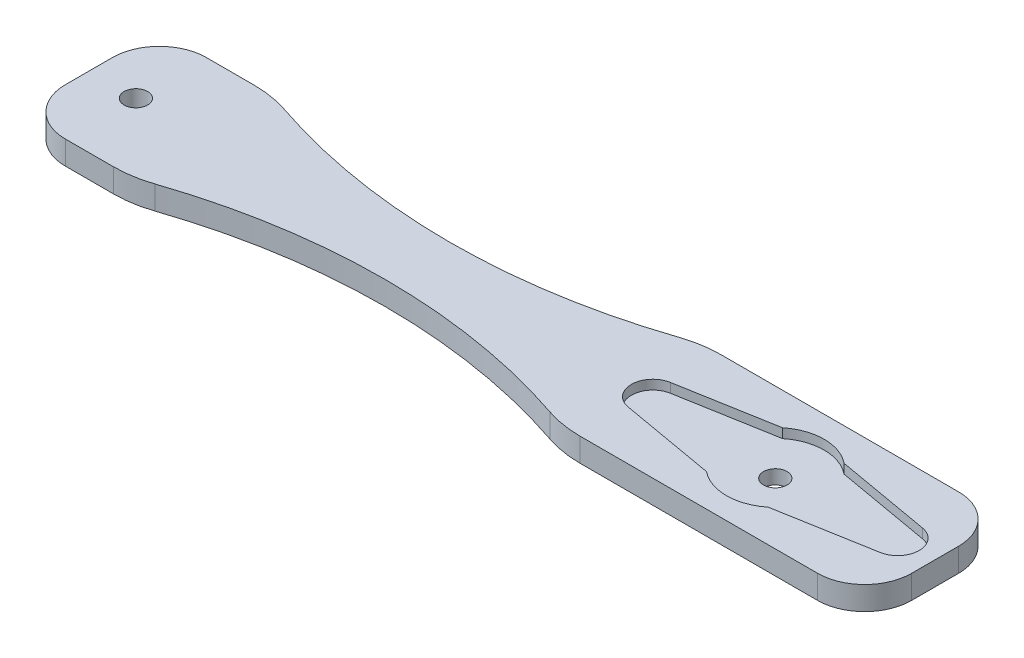
from build123d import *

# Parameters (mm, degrees)
BOSS_EXTRUDE1_DEPTH          = 3.175
CUT_EXTRUDE2_DEPTH           = 1.27
F_1_8_0_125_DIAMETER_HOLE1_D = 3.175
CUT_EXTRUDE3_DEPTH           = 116.920115273
FILLET1_R                    = 15
F_1_8_0_125_DIAMETER_HOLE2_D = 3.175


with BuildPart() as part:
    # Sketch1 → Boss-Extrude1 (new body)
    with BuildSketch(Plane(origin=(0, 0, 0), x_dir=(1, 0, 0), z_dir=(0, 1, 0))):
        with BuildLine():
            Line((6.35, 0), (107.95, 0))
            ThreePointArc((107.95, 0), (112.440128061, 1.859871939), (114.3, 6.35))
            Line((114.3, 6.35), (114.3, 12.7))
            ThreePointArc((114.3, 12.7), (112.440128061, 17.190128061), (107.95, 19.05))
            Line((107.95, 19.05), (6.35, 19.05))
            ThreePointArc((6.35, 19.05), (1.859871939, 17.190128061), (0, 12.7))
            Line((0, 12.7), (0, 6.35))
            ThreePointArc((0, 6.35), (1.859871939, 1.859871939), (6.35, 0))
        make_face()
    extrude(amount=BOSS_EXTRUDE1_DEPTH)

    # Sketch4 → Cut-Extrude2 (cut)
    with BuildSketch(Plane(origin=(0, 3.175, 0), x_dir=(1, 0, 0), z_dir=(0, 1, 0))):
        with BuildLine():
            Line((109.744274308, 12.384881715), (96.868569632, 14.655215845))
            ThreePointArc((96.868569632, 14.655215845), (92.71, 16.129), (88.551430368, 14.655215845))
            Line((88.551430368, 14.655215845), (75.675725692, 12.384881715))
            ThreePointArc((75.675725692, 12.384881715), (73.276, 9.525), (75.675725692, 6.665118285))
            Line((75.675725692, 6.665118285), (88.551430368, 4.394784155))
            ThreePointArc((88.551430368, 4.394784155), (92.71, 2.921), (96.868569632, 4.394784155))
            Line((96.868569632, 4.394784155), (109.744274308, 6.665118285))
            ThreePointArc((109.744274308, 6.665118285), (112.144, 9.525), (109.744274308, 12.384881715))
        make_face()
    extrude(amount=-CUT_EXTRUDE2_DEPTH, mode=Mode.SUBTRACT)

    # 1/8 (0.125) Diameter Hole1 (through all)
    with Locations(Plane(origin=(0, 3.175, 0), x_dir=(1, 0, 0), z_dir=(0, 1, 0))):
        with Locations((6.35, 9.525)):
            Hole(F_1_8_0_125_DIAMETER_HOLE1_D / 2)

    # Sketch7 → Cut-Extrude3 (cut, through all)
    with BuildSketch(Plane(origin=(0, 3.175, 0), x_dir=(1, 0, 0), z_dir=(0, 1, 0))):
        with BuildLine():
            Line((15.415253533, 19.05), (73.276, 19.05))
            ThreePointArc((73.276, 19.05), (44.345626766, 13.880082039), (15.415253533, 19.05))
        make_face()
        with BuildLine():
            Line((73.276, 0), (15.415253533, 0))
            ThreePointArc((15.415253533, 0), (44.345626766, 5.169917961), (73.276, 0))
        make_face()
    extrude(amount=-CUT_EXTRUDE3_DEPTH, mode=Mode.SUBTRACT)

    # Fillet1
    fillet1_edges = [part.edges().sort_by_distance(p)[0] for p in [
        (73.276, 1.5875, -19.05),
        (15.415253533, 1.5875, -19.05),
        (15.415253533, 1.5875, 0),
        (73.276, 1.5875, 0),
    ]]
    fillet(fillet1_edges, radius=FILLET1_R)

    # 1/8 (0.125) Diameter Hole2 (through all)
    with Locations(Plane(origin=(0, 3.175, 0), x_dir=(1, 0, 0), z_dir=(0, 1, 0))):
        with Locations((92.71, 9.525)):
            Hole(F_1_8_0_125_DIAMETER_HOLE2_D / 2)


solid = part.part
